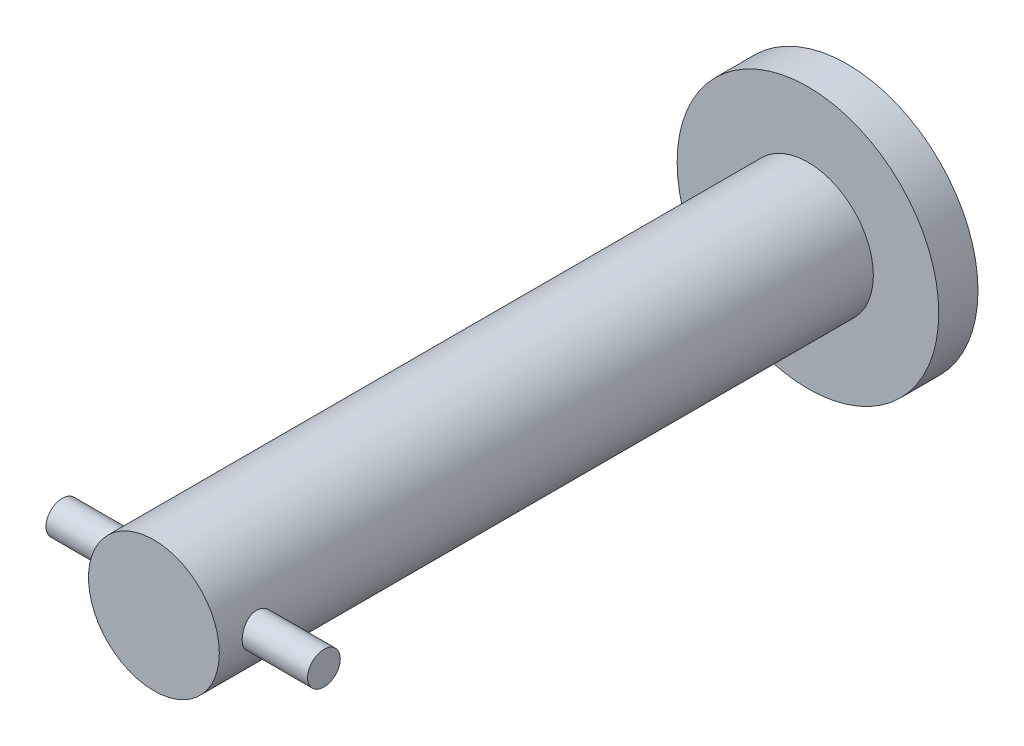
from build123d import *

# Parameters (mm, degrees)
SKETCH1_R                = 10
SKETCH1_R_2              = 5
BOSS_EXTRUDE1_DEPTH      = 5
SKETCH1_2_R              = 5
BOSS_EXTRUDE2_DEPTH      = 55
CHAMFER1_SIZE            = 3
CHAMFER1_SIZE2           = 2
BOSS_EXTRUDE3_DEPTH      = 10
BOSS_EXTRUDE3_DEPTH_BACK = 10
SKETCH2_R                = 1.25


with BuildPart() as part:
    # Sketch1 → Boss-Extrude1 (new body)
    with BuildSketch(Plane.XY):
        Circle(SKETCH1_R)
        Circle(SKETCH1_R_2, mode=Mode.SUBTRACT)
    extrude(amount=BOSS_EXTRUDE1_DEPTH)

    # Sketch1<2> → Boss-Extrude2 (add)
    with BuildSketch(Plane.XY):
        Circle(SKETCH1_2_R)
    extrude(amount=BOSS_EXTRUDE2_DEPTH)

    # Chamfer1
    chamfer1_edges = [part.edges().sort_by_distance(p)[0] for p in [
        (-10, 0, 0),
    ]]
    chamfer1_side = [part.faces().sort_by_distance(p)[0] for p in [
        (0, 0, 0),
    ]]
    chamfer(chamfer1_edges, length=CHAMFER1_SIZE, length2=CHAMFER1_SIZE2, reference=chamfer1_side[0])

    # Sketch2 → Boss-Extrude3 (add, two sides: drawn at the far end of the back side and taken through both)
    with BuildSketch(Plane(origin=(0, 0, 0), x_dir=(0, 0, -1), z_dir=(1, 0, 0)).offset(-BOSS_EXTRUDE3_DEPTH_BACK)):
        with Locations((-52, 0)):
            Circle(SKETCH2_R)
    extrude(amount=BOSS_EXTRUDE3_DEPTH + BOSS_EXTRUDE3_DEPTH_BACK)


solid = part.part
